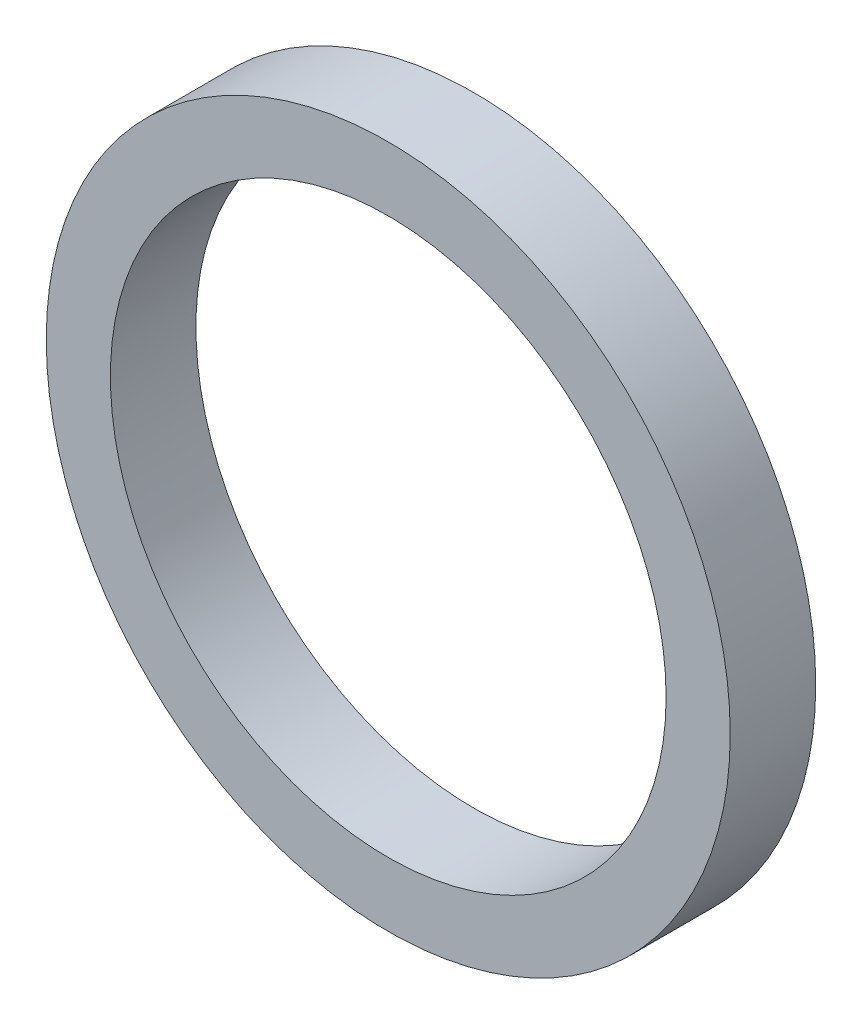
from build123d import *

# Parameters (mm, degrees)
SKETCH_1_R      = 40
SKETCH_1_R_2    = 32.5
EXTRUDE_1_DEPTH = 10


with BuildPart() as part:
    # 草图1 → 凸台-拉伸1 (new body)
    with BuildSketch(Plane.XY):
        Circle(SKETCH_1_R)
        Circle(SKETCH_1_R_2, mode=Mode.SUBTRACT)
    extrude(amount=EXTRUDE_1_DEPTH)


solid = part.part
